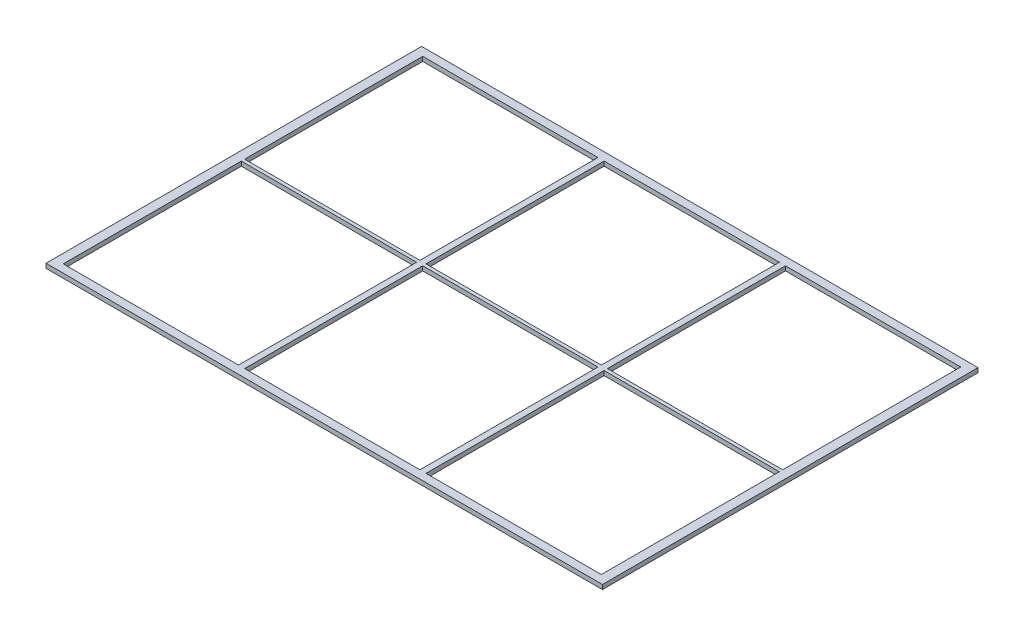
from build123d import *

# Parameters (mm, degrees)
SKETCH1_W            = 200
SKETCH1_H            = 135
BOSS_EXTRUDE1_DEPTH  = 1.6
SKETCH2_W            = 63
SKETCH2_H            = 64
CUT_EXTRUDE1_DEPTH   = 1.6
LPATTERN1_COUNT      = 3
LPATTERN1_PITCH      = 65.2
LPATTERN1_COUNT_DIR2 = 2
LPATTERN1_PITCH_DIR2 = 65.2


with BuildPart() as part:
    # Sketch1 → Boss-Extrude1 (new body)
    with BuildSketch(Plane(origin=(0, 0, 0), x_dir=(1, 0, 0), z_dir=(0, 1, 0))):
        Rectangle(SKETCH1_W, SKETCH1_H)
    extrude(amount=BOSS_EXTRUDE1_DEPTH)

    # Sketch2 → Cut-Extrude1 (cut)
    with BuildSketch(Plane(origin=(0, 1.6, 0), x_dir=(1, 0, 0), z_dir=(0, 1, 0))):
        with Locations((-65.2, 32.6)):
            Rectangle(SKETCH2_W, SKETCH2_H)
    cut_extrude1 = extrude(amount=-CUT_EXTRUDE1_DEPTH, mode=Mode.SUBTRACT)

    # LPattern1: Cut-Extrude1 3 × 2
    with Locations(*[(i * LPATTERN1_PITCH, 0, j * LPATTERN1_PITCH_DIR2) for i in range(LPATTERN1_COUNT) for j in range(LPATTERN1_COUNT_DIR2) if (i, j) != (0, 0)]):
        add(cut_extrude1, mode=Mode.SUBTRACT)


solid = part.part
